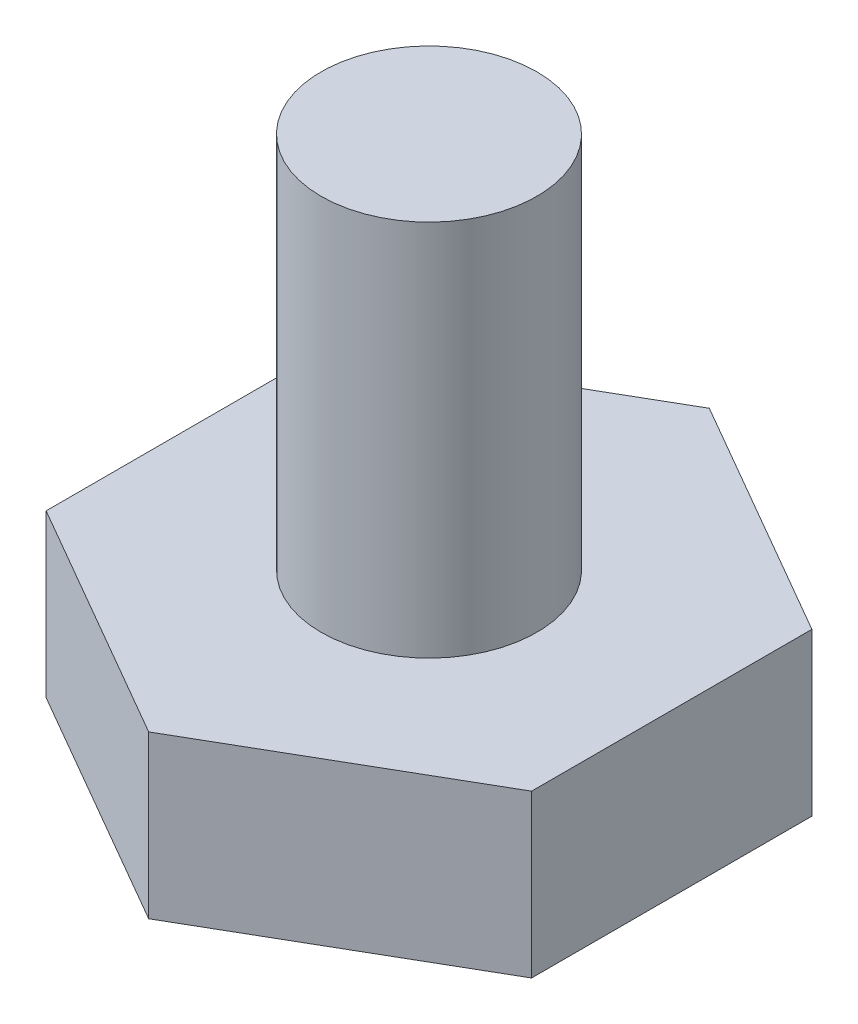
from build123d import *

# Parameters (mm, degrees)
BOSS_EXTRUDE1_DEPTH = 2.38125
SKETCH2_R           = 3.175
BOSS_EXTRUDE2_DEPTH = 11.1125


with BuildPart() as part:
    # Sketch1 → Boss-Extrude1 (new, symmetric)
    with BuildSketch(Plane(origin=(0, 0, 0), x_dir=(1, 0, 0), z_dir=(0, 1, 0))):
        Polygon((0, 8.248891971), (-7.14375, 4.124445986), (-7.14375, -4.124445986), (0, -8.248891971), (7.14375, -4.124445986), (7.14375, 4.124445986), align=None)
    extrude(amount=BOSS_EXTRUDE1_DEPTH, both=True)

    # Sketch2 → Boss-Extrude2 (add)
    with BuildSketch(Plane(origin=(0, 2.38125, 0), x_dir=(1, 0, 0), z_dir=(0, 1, 0))):
        with Locations(Location((0, 0, 0), (0, 0, 270))):
            Circle(SKETCH2_R)
    extrude(amount=BOSS_EXTRUDE2_DEPTH)


solid = part.part
